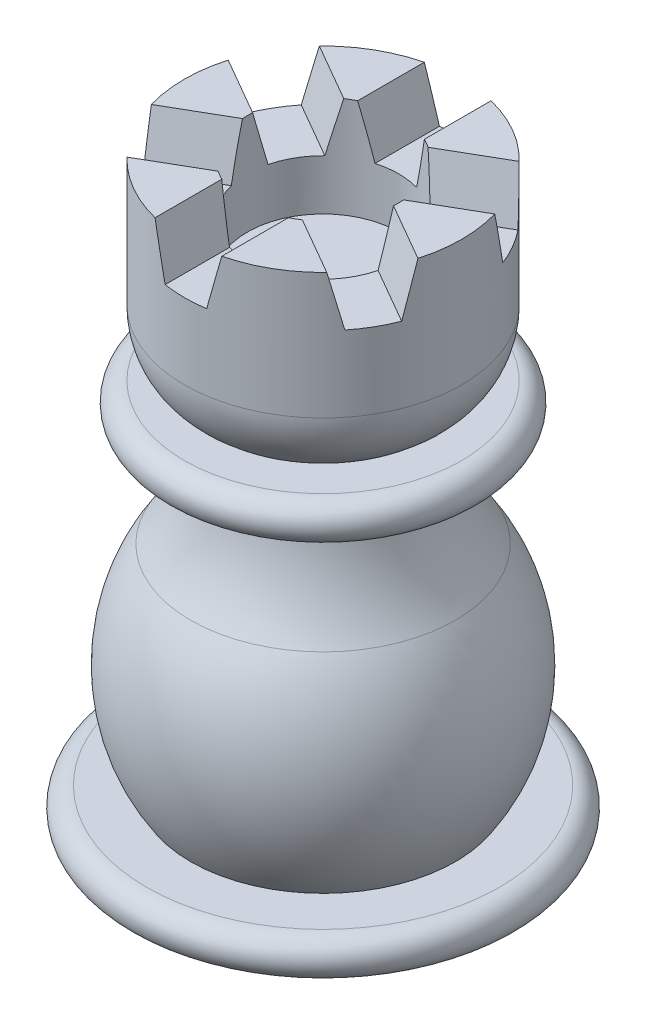
from build123d import *

# Parameters (mm, degrees)
SKETCH2_R          = 6
CUT_EXTRUDE1_DEPTH = 8
CUT_EXTRUDE2_DEPTH = 51.955863315
CIRPATTERN1_COUNT  = 6


with BuildPart() as part:
    # Sketch1 → Revolve1 (revolve)
    with BuildSketch(Plane.XY, mode=Mode.PRIVATE) as revolve1_sk:
        with BuildLine():
            Line((0, 0), (11, 0))
            Line((11, 0), (11, -10))
            ThreePointArc((11, -10), (10.196152423, -13), (8, -15.196152423))
            Line((8, -15.196152423), (11, -15.196152423))
            ThreePointArc((11, -15.196152423), (12.5, -16.696152423), (11, -18.196152423))
            Line((11, -18.196152423), (8, -18.196152423))
            ThreePointArc((8, -18.196152423), (8.648844598, -22.489085058), (10.5, -26.416360653))
            ThreePointArc((10.5, -26.416360653), (13.000170941, -34.708180327), (10.5, -43))
            Line((10.5, -43), (14, -43))
            ThreePointArc((14, -43), (15.5, -44.5), (14, -46))
            Line((14, -46), (0, -46))
            Line((0, -46), (0, 0))
        make_face()
    revolve(revolve1_sk.sketch.rotate(Axis((0, 0, 0), (0, -1, 0)), 90), axis=Axis((0, 0, 0), (0, -1, 0)))

    # Sketch2 → Cut-Extrude1 (cut)
    with BuildSketch(Plane(origin=(0, 0, 0), x_dir=(1, 0, 0), z_dir=(0, 1, 0))):
        with Locations(Location((0, 0, 0), (0, 0, 270))):
            Circle(SKETCH2_R)
    extrude(amount=-CUT_EXTRUDE1_DEPTH, mode=Mode.SUBTRACT)

    # Sketch3 → Cut-Extrude2 (cut, symmetric)
    with BuildSketch(Plane.XY):
        Polygon((-2.646002044, 0), (-1.648690033, -4), (1.648690033, -4), (2.353997956, 0), align=None)
    cut_extrude2 = extrude(amount=CUT_EXTRUDE2_DEPTH, both=True, mode=Mode.SUBTRACT)

    # CirPattern1: Cut-Extrude2 ×6 about axis
    cirpattern1_axis = Axis((0, 0, 0), (0, 1, 0))
    for i in range(1, CIRPATTERN1_COUNT):
        add(cut_extrude2.rotate(cirpattern1_axis, i * 360 / CIRPATTERN1_COUNT), mode=Mode.SUBTRACT)


solid = part.part
